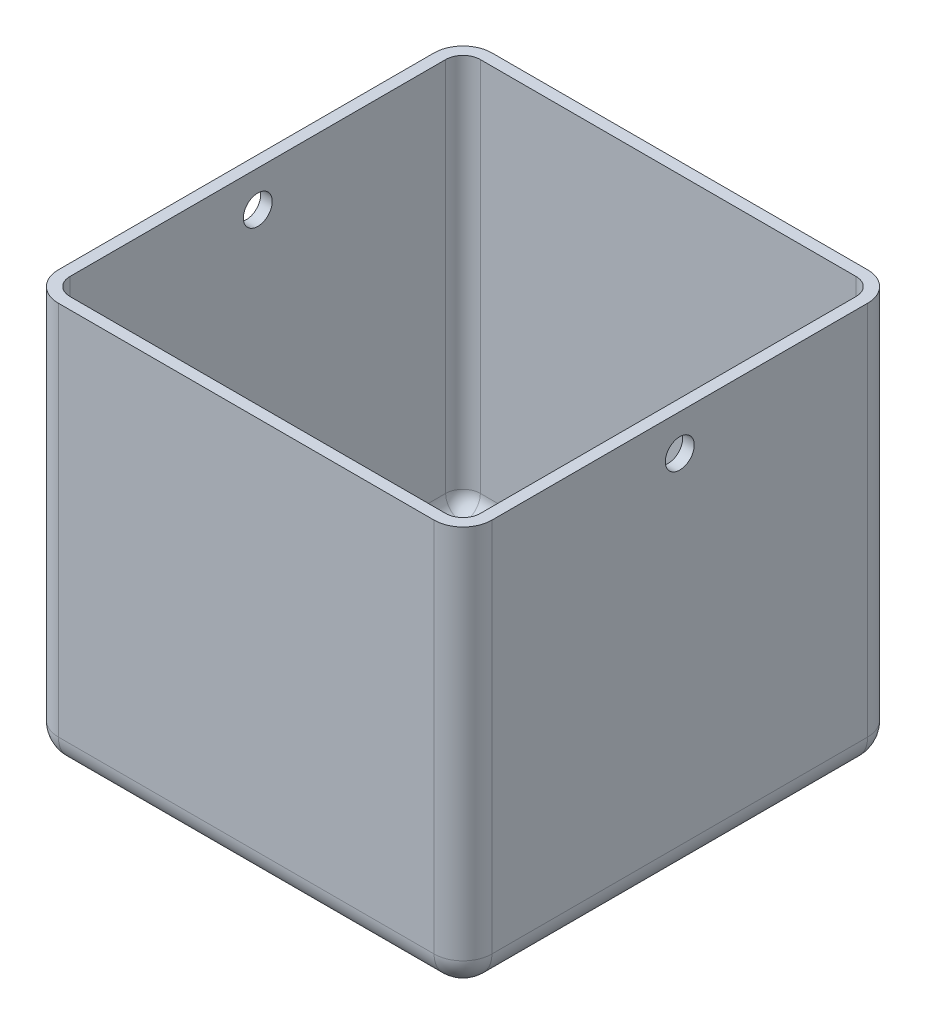
from build123d import *

# Parameters (mm, degrees)
SKETCH1_W           = 60
SKETCH1_H           = 60
BOSS_EXTRUDE1_DEPTH = 56
FILLET1_R           = 4
SHELL1_T            = -1.6
CUT_EXTRUDE1_DEPTH  = 69.988114918
BOSS_EXTRUDE2_START = 8
BOSS_EXTRUDE2_DEPTH = 8
CUT_EXTRUDE2_REACH  = 78.245
SKETCH3_R           = 2.4
CUT_EXTRUDE3_REACH  = 89.384


with BuildPart() as part:
    # Sketch1 → Boss-Extrude1 (new body)
    with BuildSketch(Plane(origin=(0, 0, 0), x_dir=(1, 0, 0), z_dir=(0, 1, 0))):
        Rectangle(SKETCH1_W, SKETCH1_H)
    extrude(amount=BOSS_EXTRUDE1_DEPTH)

    # Fillet1
    fillet1_edges = [part.edges().sort_by_distance(p)[0] for p in [
        (0, 0, 30),
        (-30, 0, 0),
        (0, 0, -30),
        (30, 0, 0),
        (30, 28, 30),
        (-30, 28, 30),
        (-30, 28, -30),
        (30, 28, -30),
    ]]
    fillet(fillet1_edges, radius=FILLET1_R)

    # Shell1
    shell1_openings = [part.faces().sort_by_distance(p)[0] for p in [
        (0, 56, 0),
    ]]
    offset(amount=SHELL1_T, openings=shell1_openings, kind=Kind.INTERSECTION)

    # Sketch2 → Cut-Extrude1 (cut, through all)
    with BuildSketch(Plane(origin=(0, 1.6, 0), x_dir=(1, 0, 0), z_dir=(0, 1, 0))):
        with BuildLine():
            Line((18.864939852, 1.60266636), (12.761084932, 8.2247849))
            ThreePointArc((12.761084932, 8.2247849), (10.757749844, 9.653700125), (8.349320226, 10.158295975))
            Line((8.349320226, 10.158295975), (-8.295911111, 10.158295975))
            ThreePointArc((-8.295911111, 10.158295975), (-10.704340729, 9.653700125), (-12.707675817, 8.2247849))
            Line((-12.707675817, 8.2247849), (-18.811530736, 1.60266636))
            ThreePointArc((-18.811530736, 1.60266636), (-19.473295442, -0.091704025), (-18.811530736, -1.786074411))
            Line((-18.811530736, -1.786074411), (-12.707675817, -8.408192951))
            ThreePointArc((-12.707675817, -8.408192951), (-10.704340729, -9.837108176), (-8.295911111, -10.341704025))
            Line((-8.295911111, -10.341704025), (8.349320226, -10.341704025))
            ThreePointArc((8.349320226, -10.341704025), (10.757749844, -9.837108176), (12.761084932, -8.408192951))
            Line((12.761084932, -8.408192951), (18.864939852, -1.786074411))
            ThreePointArc((18.864939852, -1.786074411), (19.526704558, -0.091704025), (18.864939852, 1.60266636))
        make_face()
    extrude(amount=-CUT_EXTRUDE1_DEPTH, mode=Mode.SUBTRACT)

    # Sketch2<4> → Boss-Extrude2 (add)
    with BuildSketch(Plane(origin=(0, 1.6, 0), x_dir=(1, 0, 0), z_dir=(0, 1, 0)).offset(BOSS_EXTRUDE2_START)):
        with BuildLine():
            Line((20.335528087, 2.958162669), (14.231673168, 9.580281209))
            ThreePointArc((14.231673168, 9.580281209), (11.560559717, 11.485501509), (8.349320226, 12.158295975))
            Line((8.349320226, 12.158295975), (-8.295911111, 12.158295975))
            ThreePointArc((-8.295911111, 12.158295975), (-11.507150601, 11.485501509), (-14.178264052, 9.580281209))
            Line((-14.178264052, 9.580281209), (-20.282118972, 2.958162669))
            ThreePointArc((-20.282118972, 2.958162669), (-21.473295442, -0.091704025), (-20.282118972, -3.141570719))
            Line((-20.282118972, -3.141570719), (-14.178264052, -9.763689259))
            ThreePointArc((-14.178264052, -9.763689259), (-11.507150601, -11.668909559), (-8.295911111, -12.341704025))
            Line((-8.295911111, -12.341704025), (8.349320226, -12.341704025))
            ThreePointArc((8.349320226, -12.341704025), (11.560559717, -11.668909559), (14.231673168, -9.763689259))
            Line((14.231673168, -9.763689259), (20.335528087, -3.141570719))
            ThreePointArc((20.335528087, -3.141570719), (21.526704558, -0.091704025), (20.335528087, 2.958162669))
        make_face()
        with BuildLine():
            Line((18.864939852, 1.60266636), (12.761084932, 8.2247849))
            ThreePointArc((12.761084932, 8.2247849), (10.757749844, 9.653700125), (8.349320226, 10.158295975))
            Line((8.349320226, 10.158295975), (-8.295911111, 10.158295975))
            ThreePointArc((-8.295911111, 10.158295975), (-10.704340729, 9.653700125), (-12.707675817, 8.2247849))
            Line((-12.707675817, 8.2247849), (-18.811530736, 1.60266636))
            ThreePointArc((-18.811530736, 1.60266636), (-19.473295442, -0.091704025), (-18.811530736, -1.786074411))
            Line((-18.811530736, -1.786074411), (-12.707675817, -8.408192951))
            ThreePointArc((-12.707675817, -8.408192951), (-10.704340729, -9.837108176), (-8.295911111, -10.341704025))
            Line((-8.295911111, -10.341704025), (8.349320226, -10.341704025))
            ThreePointArc((8.349320226, -10.341704025), (10.757749844, -9.837108176), (12.761084932, -8.408192951))
            Line((12.761084932, -8.408192951), (18.864939852, -1.786074411))
            ThreePointArc((18.864939852, -1.786074411), (19.526704558, -0.091704025), (18.864939852, 1.60266636))
        make_face(mode=Mode.SUBTRACT)
    extrude(amount=-BOSS_EXTRUDE2_DEPTH)

    # Cut-Extrude2: up to this face of the body (flat: up to its plane)
    cut_extrude2_end = Plane(part.part.faces().sort_by_distance((0.026704558, 5.6, 12.341704025))[0])
    # Sketch3 → Cut-Extrude2 (cut, up to the picked face)
    with BuildSketch(Plane(origin=(0, 0, -12.158295975), x_dir=(-1, 0, 0), z_dir=(0, 0, -1)), mode=Mode.PRIVATE) as cut_extrude2_sk1:
        with Locations((-0.026704558, 5.6)):
            Circle(SKETCH3_R)
    cut_extrude2_tool1 = split(extrude(cut_extrude2_sk1.sketch, amount=-CUT_EXTRUDE2_REACH, mode=Mode.PRIVATE), bisect_by=cut_extrude2_end, keep=Keep.BOTH, mode=Mode.PRIVATE)
    add(cut_extrude2_tool1.solids().sort_by(Axis((0.026705, 5.6, -12.158296), (0, 0, 1)))[0], mode=Mode.SUBTRACT)

    # Cut-Extrude3: up to this face of the body (flat: up to its plane)
    cut_extrude3_end = Plane(part.part.faces().sort_by_distance((-30, 30, 0))[0])
    # Sketch4 → Cut-Extrude3 (cut, up to the picked face)
    with BuildSketch(Plane(origin=(30, 0, 0), x_dir=(0, 0, -1), z_dir=(1, 0, 0)), mode=Mode.PRIVATE) as cut_extrude3_sk1:
        with BuildLine():
            ThreePointArc((2, 51), (1.414213562, 52.414213562), (0, 53))
            Line((0, 53), (0, 49))
            ThreePointArc((0, 49), (1.414213562, 49.585786438), (2, 51))
        make_face()
    cut_extrude3_tool1 = split(extrude(cut_extrude3_sk1.sketch, amount=-CUT_EXTRUDE3_REACH, mode=Mode.PRIVATE), bisect_by=cut_extrude3_end, keep=Keep.BOTH, mode=Mode.PRIVATE)
    # Sketch4 → Cut-Extrude3 (cut, up to the picked face)
    with BuildSketch(Plane(origin=(30, 0, 0), x_dir=(0, 0, -1), z_dir=(1, 0, 0)), mode=Mode.PRIVATE) as cut_extrude3_sk2:
        with BuildLine():
            Line((0, 49), (0, 53))
            ThreePointArc((0, 53), (-2, 51), (0, 49))
        make_face()
    cut_extrude3_tool2 = split(extrude(cut_extrude3_sk2.sketch, amount=-CUT_EXTRUDE3_REACH, mode=Mode.PRIVATE), bisect_by=cut_extrude3_end, keep=Keep.BOTH, mode=Mode.PRIVATE)
    # Sketch4 → Cut-Extrude3 (cut, up to the picked face)
    with BuildSketch(Plane(origin=(30, 0, 0), x_dir=(0, 0, -1), z_dir=(1, 0, 0)), mode=Mode.PRIVATE) as cut_extrude3_sk3:
        with BuildLine():
            ThreePointArc((2, 51), (1.414213562, 52.414213562), (0, 53))
            Line((0, 53), (0, 49))
            ThreePointArc((0, 49), (1.414213562, 49.585786438), (2, 51))
        make_face()
    cut_extrude3_tool3 = split(extrude(cut_extrude3_sk3.sketch, amount=-CUT_EXTRUDE3_REACH, mode=Mode.PRIVATE), bisect_by=cut_extrude3_end, keep=Keep.BOTH, mode=Mode.PRIVATE)
    # Sketch4 → Cut-Extrude3 (cut, up to the picked face)
    with BuildSketch(Plane(origin=(30, 0, 0), x_dir=(0, 0, -1), z_dir=(1, 0, 0)), mode=Mode.PRIVATE) as cut_extrude3_sk4:
        with BuildLine():
            Line((0, 49), (0, 53))
            ThreePointArc((0, 53), (-2, 51), (0, 49))
        make_face()
    cut_extrude3_tool4 = split(extrude(cut_extrude3_sk4.sketch, amount=-CUT_EXTRUDE3_REACH, mode=Mode.PRIVATE), bisect_by=cut_extrude3_end, keep=Keep.BOTH, mode=Mode.PRIVATE)
    add(cut_extrude3_tool1.solids().sort_by(Axis((30, 51, -0.848826), (-1, 0, 0)))[0], mode=Mode.SUBTRACT)
    add(cut_extrude3_tool2.solids().sort_by(Axis((30, 51, 0.848826), (-1, 0, 0)))[0], mode=Mode.SUBTRACT)
    add(cut_extrude3_tool3.solids().sort_by(Axis((30, 51, -0.848826), (-1, 0, 0)))[0], mode=Mode.SUBTRACT)
    add(cut_extrude3_tool4.solids().sort_by(Axis((30, 51, 0.848826), (-1, 0, 0)))[0], mode=Mode.SUBTRACT)


solid = part.part
